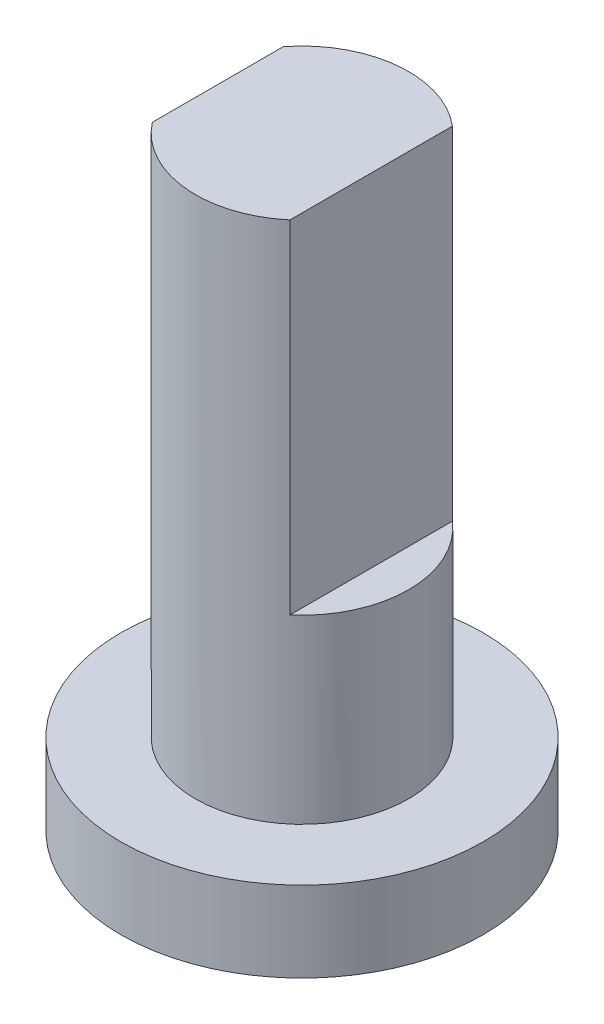
from build123d import *

# Parameters (mm, degrees)
SKETCH1_R           = 4.5
BOSS_EXTRUDE1_DEPTH = 2
SKETCH2_R           = 2.65
BOSS_EXTRUDE2_DEPTH = 4.5
BOSS_EXTRUDE3_DEPTH = 8.5


with BuildPart() as part:
    # Sketch1 → Boss-Extrude1 (new body)
    with BuildSketch(Plane(origin=(0, 0, 0), x_dir=(1, 0, 0), z_dir=(0, 1, 0))):
        with Locations(Location((0, 0, 0), (0, 0, 270))):
            Circle(SKETCH1_R)
    extrude(amount=BOSS_EXTRUDE1_DEPTH)

    # Sketch2 → Boss-Extrude2 (add)
    with BuildSketch(Plane(origin=(0, 2, 0), x_dir=(1, 0, 0), z_dir=(0, 1, 0))):
        with Locations(Location((0, 0, 0), (0, 0, 270))):
            Circle(SKETCH2_R)
    extrude(amount=BOSS_EXTRUDE2_DEPTH)

    # Sketch4 → Boss-Extrude3 (add)
    with BuildSketch(Plane(origin=(0, 6.5, 0), x_dir=(1, 0, 0), z_dir=(0, 1, 0))):
        with BuildLine():
            Line((1.718727688, -2.017046141), (1.718727688, 2.017046141))
            ThreePointArc((1.718727688, 2.017046141), (-0.269470865, 2.63626354), (-2.091272312, 1.627599495))
            Line((-2.091272312, 1.627599495), (-2.091272312, -1.627599495))
            ThreePointArc((-2.091272312, -1.627599495), (-0.269470865, -2.63626354), (1.718727688, -2.017046141))
        make_face()
    extrude(amount=BOSS_EXTRUDE3_DEPTH)


solid = part.part
